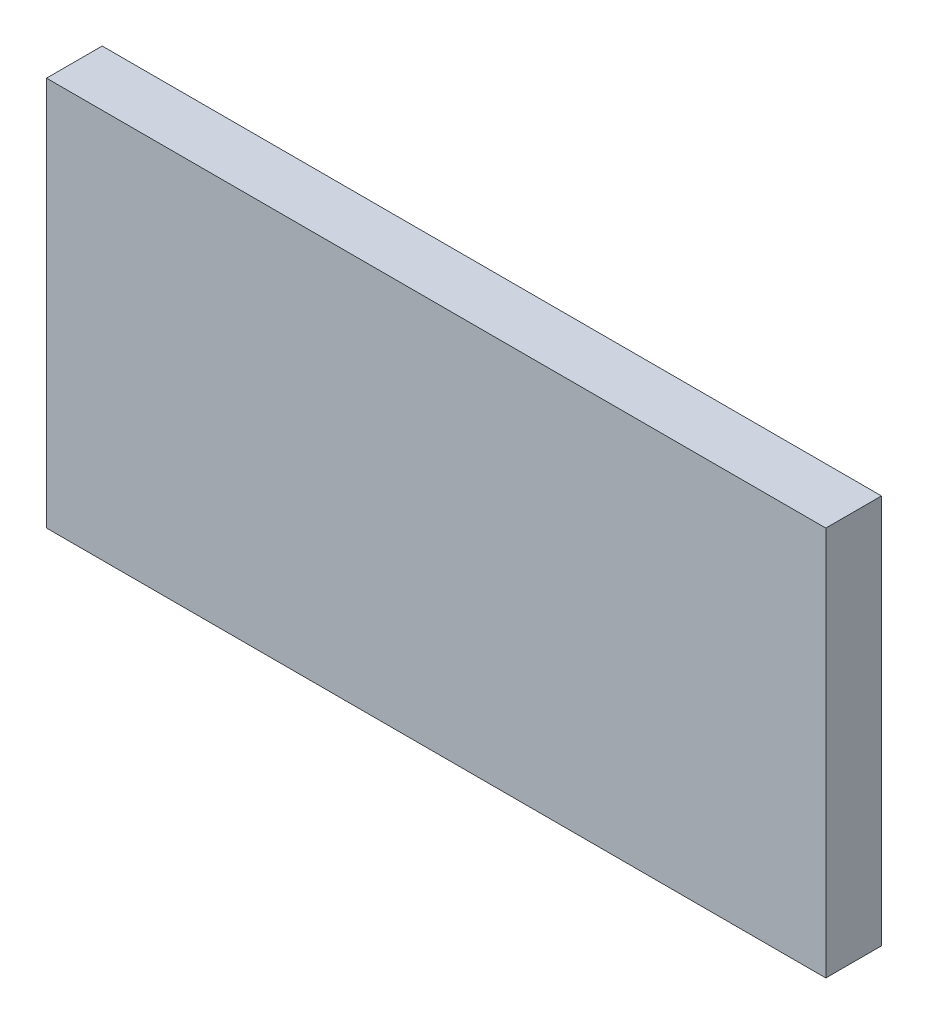
from build123d import *

# Parameters (mm, degrees)
SKETCH1_W           = 35.56
SKETCH1_H           = 17.78
BOSS_EXTRUDE1_DEPTH = 2.54


with BuildPart() as part:
    # Sketch1 → Boss-Extrude1 (new body)
    with BuildSketch(Plane.XY):
        Rectangle(SKETCH1_W, SKETCH1_H)
    extrude(amount=BOSS_EXTRUDE1_DEPTH)


solid = part.part
